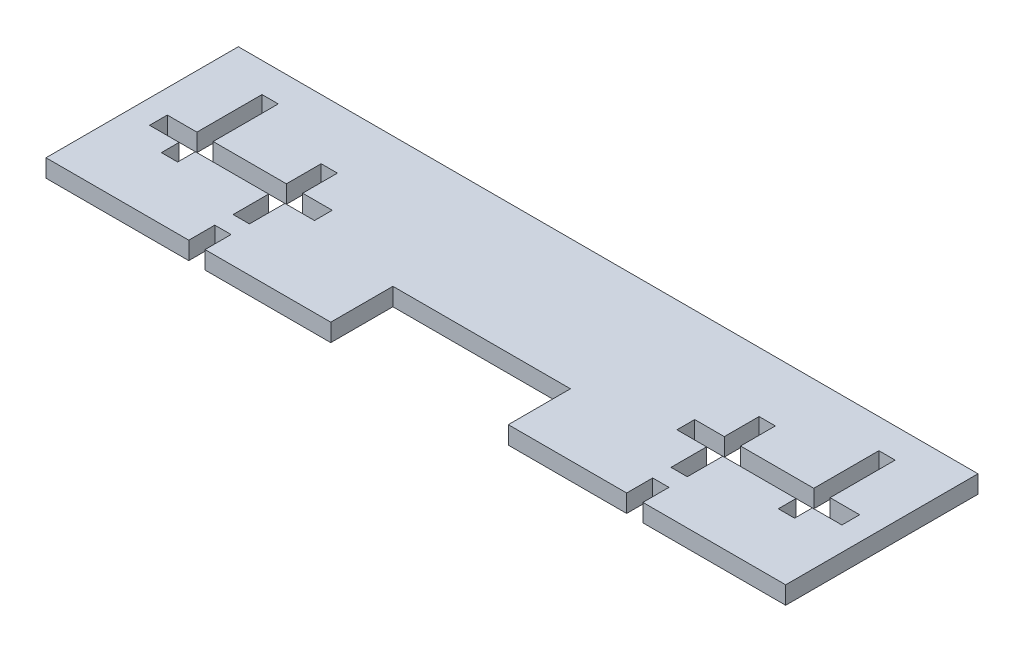
from build123d import *

# Parameters (mm, degrees)
SKETCH1_W           = 250
SKETCH1_H           = 65
BOSS_EXTRUDE1_DEPTH = 6
SKETCH2_W           = 5.5
SKETCH2_H           = 34
SKETCH2_H_2         = 47.5
CUT_EXTRUDE1_DEPTH  = 259.381500886
SKETCH3_W           = 60
SKETCH3_H           = 21
CUT_EXTRUDE2_DEPTH  = 259.381500886
SKETCH4_W           = 55.75
SKETCH4_H           = 6
CUT_EXTRUDE3_DEPTH  = 259.381500886
SKETCH5_W           = 5.5
SKETCH5_H           = 6.2
BOSS_EXTRUDE2_DEPTH = 6


with BuildPart() as part:
    # Sketch1 → Boss-Extrude1 (new body)
    with BuildSketch(Plane(origin=(0, 0, 0), x_dir=(1, 0, 0), z_dir=(0, 1, 0))):
        with Locations((125, 32.5)):
            Rectangle(SKETCH1_W, SKETCH1_H)
    extrude(amount=BOSS_EXTRUDE1_DEPTH)

    # Sketch2 → Cut-Extrude1 (cut, through all)
    with BuildSketch(Plane(origin=(0, 6, 0), x_dir=(1, 0, 0), z_dir=(0, 1, 0))):
        with Locations((20.75, 38)):
            Rectangle(SKETCH2_W, SKETCH2_H)
        with Locations((51, 21)):
            Rectangle(SKETCH2_W, SKETCH2_H_2)
        with Locations((199, 21)):
            Rectangle(SKETCH2_W, SKETCH2_H_2)
        with Locations((229.25, 38)):
            Rectangle(SKETCH2_W, SKETCH2_H)
    extrude(amount=-CUT_EXTRUDE1_DEPTH, mode=Mode.SUBTRACT)

    # Sketch3 → Cut-Extrude2 (cut, through all)
    with BuildSketch(Plane(origin=(0, 6, 0), x_dir=(1, 0, 0), z_dir=(0, 1, 0))):
        with Locations((126.25, 10.5)):
            Rectangle(SKETCH3_W, SKETCH3_H)
    extrude(amount=-CUT_EXTRUDE2_DEPTH, mode=Mode.SUBTRACT)

    # Sketch4 → Cut-Extrude3 (cut, through all)
    with BuildSketch(Plane(origin=(0, 6, 0), x_dir=(1, 0, 0), z_dir=(0, 1, 0))):
        with Locations((35.875, 30)):
            Rectangle(SKETCH4_W, SKETCH4_H)
    cut_extrude3 = extrude(amount=-CUT_EXTRUDE3_DEPTH, mode=Mode.SUBTRACT)

    # Sketch5 → Boss-Extrude2 (add)
    with BuildSketch(Plane(origin=(0, 6, 0), x_dir=(1, 0, 0), z_dir=(0, 1, 0))):
        with Locations((51, 11.9)):
            Rectangle(SKETCH5_W, SKETCH5_H)
    boss_extrude2 = extrude(amount=-BOSS_EXTRUDE2_DEPTH)

    # Mirror1: Cut-Extrude3, Boss-Extrude2 across plane
    add(cut_extrude3.mirror(Plane(origin=(125, 0, 0), x_dir=(0, 0, 1), z_dir=(1, 0, 0))), mode=Mode.SUBTRACT)
    add(boss_extrude2.mirror(Plane(origin=(125, 0, 0), x_dir=(0, 0, 1), z_dir=(1, 0, 0))))


solid = part.part
